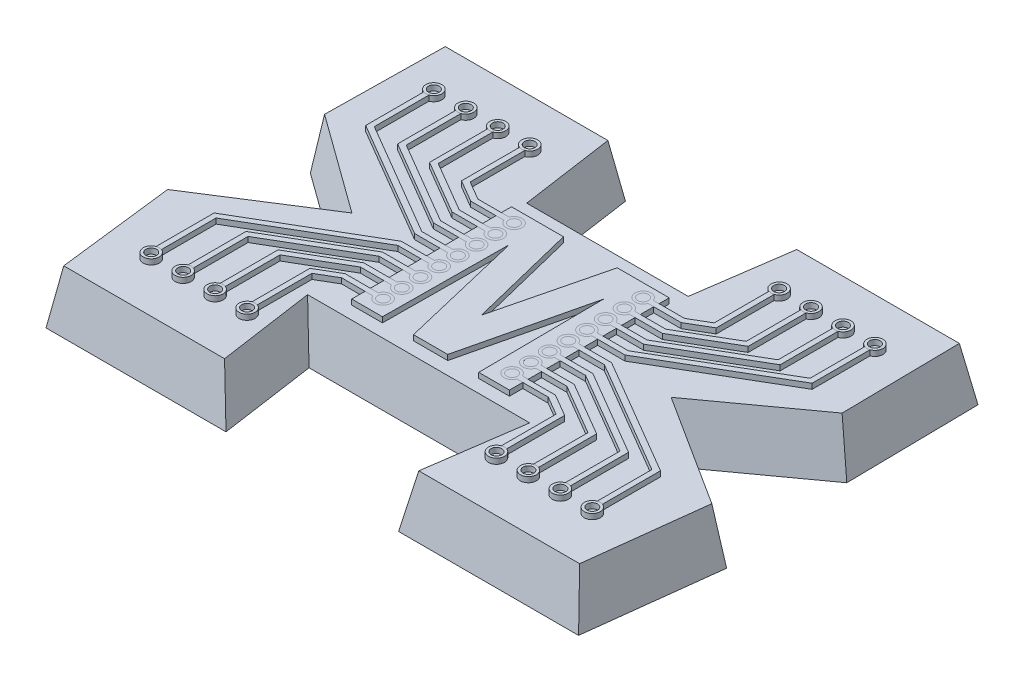
from build123d import *

# Parameters (mm, degrees)
EXTRUDE_X_DEPTH    = 20
EXTRUDE_X_TAPER    = 10
M_CUT_DEPTH        = 5
SKETCH_8_R         = 3
SKETCH_8_R_2       = 2
HOLES_CUT_DEPTH    = 5
SKETCH_9_R         = 3
SKETCH_9_R_2       = 2
M_HOLES_DEPTH      = 7
M_HOLES_2_DEPTH    = 7
M_HOLES_3_DEPTH    = 7
M_HOLES_4_DEPTH    = 7
M_HOLES_5_DEPTH    = 7
M_HOLES_6_DEPTH    = 7
M_HOLES_7_DEPTH    = 7
M_HOLES_8_DEPTH    = 7
M_HOLES_9_DEPTH    = 7
M_HOLES_10_DEPTH   = 7
M_HOLES_11_DEPTH   = 7
M_HOLES_12_DEPTH   = 7
M_HOLES_13_DEPTH   = 7
M_HOLES_14_DEPTH   = 7
M_HOLES_15_DEPTH   = 7
M_HOLES_16_DEPTH   = 7
ROUTES_DEPTH       = 2
ROUTES_DEPTH_BACK  = 5
SKETCH_11_R        = 2
EXTRUDE_M_DEPTH    = 7
EXTRUDE_M_2_DEPTH  = 7
EXTRUDE_M_3_DEPTH  = 7
EXTRUDE_M_4_DEPTH  = 7
EXTRUDE_M_5_DEPTH  = 7
EXTRUDE_M_6_DEPTH  = 7
EXTRUDE_M_7_DEPTH  = 7
EXTRUDE_M_8_DEPTH  = 7
EXTRUDE_M_9_DEPTH  = 7
EXTRUDE_M_10_DEPTH = 7
EXTRUDE_M_11_DEPTH = 7
EXTRUDE_M_12_DEPTH = 7
EXTRUDE_M_13_DEPTH = 7
EXTRUDE_M_14_DEPTH = 7
EXTRUDE_M_15_DEPTH = 7
EXTRUDE_M_16_DEPTH = 7
EXTRUDE_M_17_DEPTH = 7
SKETCH_14_R        = 3
SKETCH_14_R_2      = 2
HOLES_DEPTH        = 7
HOLES_2_DEPTH      = 7
HOLES_3_DEPTH      = 7
HOLES_4_DEPTH      = 7
HOLES_5_DEPTH      = 7
HOLES_6_DEPTH      = 7
HOLES_7_DEPTH      = 7
HOLES_8_DEPTH      = 7
HOLES_9_DEPTH      = 7
HOLES_10_DEPTH     = 7
HOLES_11_DEPTH     = 7
HOLES_12_DEPTH     = 7
HOLES_13_DEPTH     = 7
HOLES_14_DEPTH     = 7
HOLES_15_DEPTH     = 7
HOLES_16_DEPTH     = 7


with BuildPart() as part:
    # Эскиз1 → X (new body)
    with BuildSketch(Plane(origin=(0, 0, 0), x_dir=(1, 0, 0), z_dir=(0, 1, 0))):
        Polygon((0, 0), (67.599623535, 0), (62.359926215, 36.418021698), (137.640073785, 36.418021698), (132.400376465, 0), (200, 0), (205.94831436, 49.644914707), (166.200188233, 75), (200.728651396, 100.00530961), (200, 150), (132.400376465, 150), (127.274162693, 114.370734989), (72.725837307, 114.370734989), (67.599623535, 150), (0, 150), (-0.728651396, 100.00530961), (33.799811767, 75), (-5.94831436, 49.644914707), align=None)
    extrude(amount=EXTRUDE_X_DEPTH, taper=EXTRUDE_X_TAPER)

    # Эскиз6 → M cut (cut)
    with BuildSketch(Plane(origin=(0, 20, 0), x_dir=(1, 0, 0), z_dir=(0, 1, 0))):
        Polygon((70, 104.815168782), (70, 44.815168782), (81.538461538, 44.815168782), (81.923076923, 92.050745705), (93.185096154, 44.815168782), (106.045673077, 44.815168782), (117.307692308, 92.050745705), (117.692307692, 44.815168782), (129.230769231, 44.815168782), (129.230769231, 104.815168782), (109.711538462, 104.815168782), (99.615384615, 63.889688013), (89.519230769, 104.815168782), align=None)
    extrude(amount=-M_CUT_DEPTH, mode=Mode.SUBTRACT)

    # Эскиз8 → holes cut (cut)
    # profile 1 of 16: a face of its own
    with BuildSketch(Plane(origin=(0, 20, 0), x_dir=(1, 0, 0), z_dir=(0, 1, 0))):
        with Locations(Location((17.173553725, 128.473460386, 0), (0, 0, 270))):
            Circle(SKETCH_8_R)
        with Locations(Location((17.173553725, 128.473460386, 0), (0, 0, 270))):
            Circle(SKETCH_8_R_2, mode=Mode.SUBTRACT)
    # profile 2 of 16: a face of its own
    with BuildSketch(Plane(origin=(0, 20, 0), x_dir=(1, 0, 0), z_dir=(0, 1, 0))):
        with Locations(Location((29.173553725, 128.473460386, 0), (0, 0, 270))):
            Circle(SKETCH_8_R)
        with Locations(Location((29.173553725, 128.473460386, 0), (0, 0, 270))):
            Circle(SKETCH_8_R_2, mode=Mode.SUBTRACT)
    # profile 3 of 16: a face of its own
    with BuildSketch(Plane(origin=(0, 20, 0), x_dir=(1, 0, 0), z_dir=(0, 1, 0))):
        with Locations(Location((41.173553725, 128.473460386, 0), (0, 0, 270))):
            Circle(SKETCH_8_R)
        with Locations(Location((41.173553725, 128.473460386, 0), (0, 0, 270))):
            Circle(SKETCH_8_R_2, mode=Mode.SUBTRACT)
    # profile 4 of 16: a face of its own
    with BuildSketch(Plane(origin=(0, 20, 0), x_dir=(1, 0, 0), z_dir=(0, 1, 0))):
        with Locations(Location((53.173553725, 128.473460386, 0), (0, 0, 270))):
            Circle(SKETCH_8_R)
        with Locations(Location((53.173553725, 128.473460386, 0), (0, 0, 270))):
            Circle(SKETCH_8_R_2, mode=Mode.SUBTRACT)
    # profile 5 of 16: a face of its own
    with BuildSketch(Plane(origin=(0, 20, 0), x_dir=(1, 0, 0), z_dir=(0, 1, 0))):
        with Locations(Location((182.826446275, 22.326539614, 0), (0, 0, 270))):
            Circle(SKETCH_8_R)
        with Locations(Location((182.826446275, 22.326539614, 0), (0, 0, 270))):
            Circle(SKETCH_8_R_2, mode=Mode.SUBTRACT)
    # profile 6 of 16: a face of its own
    with BuildSketch(Plane(origin=(0, 20, 0), x_dir=(1, 0, 0), z_dir=(0, 1, 0))):
        with Locations(Location((170.826446275, 22.326539614, 0), (0, 0, 270))):
            Circle(SKETCH_8_R)
        with Locations(Location((170.826446275, 22.326539614, 0), (0, 0, 270))):
            Circle(SKETCH_8_R_2, mode=Mode.SUBTRACT)
    # profile 7 of 16: a face of its own
    with BuildSketch(Plane(origin=(0, 20, 0), x_dir=(1, 0, 0), z_dir=(0, 1, 0))):
        with Locations(Location((158.826446275, 22.326539614, 0), (0, 0, 270))):
            Circle(SKETCH_8_R)
        with Locations(Location((158.826446275, 22.326539614, 0), (0, 0, 270))):
            Circle(SKETCH_8_R_2, mode=Mode.SUBTRACT)
    # profile 8 of 16: a face of its own
    with BuildSketch(Plane(origin=(0, 20, 0), x_dir=(1, 0, 0), z_dir=(0, 1, 0))):
        with Locations(Location((146.826446275, 22.326539614, 0), (0, 0, 270))):
            Circle(SKETCH_8_R)
        with Locations(Location((146.826446275, 22.326539614, 0), (0, 0, 270))):
            Circle(SKETCH_8_R_2, mode=Mode.SUBTRACT)
    # profile 9 of 16: a face of its own
    with BuildSketch(Plane(origin=(0, 20, 0), x_dir=(1, 0, 0), z_dir=(0, 1, 0))):
        with Locations(Location((53.173553725, 22.326539614, 0), (0, 0, 90))):
            Circle(SKETCH_8_R)
        with Locations(Location((53.173553725, 22.326539614, 0), (0, 0, 90))):
            Circle(SKETCH_8_R_2, mode=Mode.SUBTRACT)
    # profile 10 of 16: a face of its own
    with BuildSketch(Plane(origin=(0, 20, 0), x_dir=(1, 0, 0), z_dir=(0, 1, 0))):
        with Locations(Location((41.173553725, 22.326539614, 0), (0, 0, 90))):
            Circle(SKETCH_8_R)
        with Locations(Location((41.173553725, 22.326539614, 0), (0, 0, 90))):
            Circle(SKETCH_8_R_2, mode=Mode.SUBTRACT)
    # profile 11 of 16: a face of its own
    with BuildSketch(Plane(origin=(0, 20, 0), x_dir=(1, 0, 0), z_dir=(0, 1, 0))):
        with Locations(Location((29.173553725, 22.326539614, 0), (0, 0, 90))):
            Circle(SKETCH_8_R)
        with Locations(Location((29.173553725, 22.326539614, 0), (0, 0, 90))):
            Circle(SKETCH_8_R_2, mode=Mode.SUBTRACT)
    # profile 12 of 16: a face of its own
    with BuildSketch(Plane(origin=(0, 20, 0), x_dir=(1, 0, 0), z_dir=(0, 1, 0))):
        with Locations(Location((17.173553725, 22.326539614, 0), (0, 0, 90))):
            Circle(SKETCH_8_R)
        with Locations(Location((17.173553725, 22.326539614, 0), (0, 0, 90))):
            Circle(SKETCH_8_R_2, mode=Mode.SUBTRACT)
    # profile 13 of 16: a face of its own
    with BuildSketch(Plane(origin=(0, 20, 0), x_dir=(1, 0, 0), z_dir=(0, 1, 0))):
        with Locations(Location((146.826446275, 128.473460386, 0), (0, 0, 90))):
            Circle(SKETCH_8_R)
        with Locations(Location((146.826446275, 128.473460386, 0), (0, 0, 90))):
            Circle(SKETCH_8_R_2, mode=Mode.SUBTRACT)
    # profile 14 of 16: a face of its own
    with BuildSketch(Plane(origin=(0, 20, 0), x_dir=(1, 0, 0), z_dir=(0, 1, 0))):
        with Locations(Location((158.826446275, 128.473460386, 0), (0, 0, 90))):
            Circle(SKETCH_8_R)
        with Locations(Location((158.826446275, 128.473460386, 0), (0, 0, 90))):
            Circle(SKETCH_8_R_2, mode=Mode.SUBTRACT)
    # profile 15 of 16: a face of its own
    with BuildSketch(Plane(origin=(0, 20, 0), x_dir=(1, 0, 0), z_dir=(0, 1, 0))):
        with Locations(Location((170.826446275, 128.473460386, 0), (0, 0, 90))):
            Circle(SKETCH_8_R)
        with Locations(Location((170.826446275, 128.473460386, 0), (0, 0, 90))):
            Circle(SKETCH_8_R_2, mode=Mode.SUBTRACT)
    # profile 16 of 16: a face of its own
    with BuildSketch(Plane(origin=(0, 20, 0), x_dir=(1, 0, 0), z_dir=(0, 1, 0))):
        with Locations(Location((182.826446275, 128.473460386, 0), (0, 0, 90))):
            Circle(SKETCH_8_R)
        with Locations(Location((182.826446275, 128.473460386, 0), (0, 0, 90))):
            Circle(SKETCH_8_R_2, mode=Mode.SUBTRACT)
    extrude(amount=-HOLES_CUT_DEPTH, mode=Mode.SUBTRACT)



with BuildPart() as body_2:
    # Эскиз9 → M holes (new body)
    with BuildSketch(Plane(origin=(0, 15, 0), x_dir=(1, 0, 0), z_dir=(0, 1, 0))):
        with Locations(Location((75.769230769, 50.815168782, 0), (0, 0, 270))):
            Circle(SKETCH_9_R)
        with Locations(Location((75.769230769, 50.815168782, 0), (0, 0, 270))):
            Circle(SKETCH_9_R_2, mode=Mode.SUBTRACT)
    extrude(amount=M_HOLES_DEPTH)


with BuildPart() as body_3:
    # Эскиз9 → M holes 2 (new body)
    with BuildSketch(Plane(origin=(0, 15, 0), x_dir=(1, 0, 0), z_dir=(0, 1, 0))):
        with Locations(Location((75.769230769, 57.841573241, 0), (0, 0, 270))):
            Circle(SKETCH_9_R)
        with Locations(Location((75.769230769, 57.841573241, 0), (0, 0, 270))):
            Circle(SKETCH_9_R_2, mode=Mode.SUBTRACT)
    extrude(amount=M_HOLES_2_DEPTH)


with BuildPart() as body_4:
    # Эскиз9 → M holes 3 (new body)
    with BuildSketch(Plane(origin=(0, 15, 0), x_dir=(1, 0, 0), z_dir=(0, 1, 0))):
        with Locations(Location((75.769230769, 64.867977701, 0), (0, 0, 270))):
            Circle(SKETCH_9_R)
        with Locations(Location((75.769230769, 64.867977701, 0), (0, 0, 270))):
            Circle(SKETCH_9_R_2, mode=Mode.SUBTRACT)
    extrude(amount=M_HOLES_3_DEPTH)


with BuildPart() as body_5:
    # Эскиз9 → M holes 4 (new body)
    with BuildSketch(Plane(origin=(0, 15, 0), x_dir=(1, 0, 0), z_dir=(0, 1, 0))):
        with Locations(Location((75.769230769, 71.894382161, 0), (0, 0, 270))):
            Circle(SKETCH_9_R)
        with Locations(Location((75.769230769, 71.894382161, 0), (0, 0, 270))):
            Circle(SKETCH_9_R_2, mode=Mode.SUBTRACT)
    extrude(amount=M_HOLES_4_DEPTH)


with BuildPart() as body_6:
    # Эскиз9 → M holes 5 (new body)
    with BuildSketch(Plane(origin=(0, 15, 0), x_dir=(1, 0, 0), z_dir=(0, 1, 0))):
        with Locations(Location((75.769230769, 78.920786621, 0), (0, 0, 270))):
            Circle(SKETCH_9_R)
        with Locations(Location((75.769230769, 78.920786621, 0), (0, 0, 270))):
            Circle(SKETCH_9_R_2, mode=Mode.SUBTRACT)
    extrude(amount=M_HOLES_5_DEPTH)


with BuildPart() as body_7:
    # Эскиз9 → M holes 6 (new body)
    with BuildSketch(Plane(origin=(0, 15, 0), x_dir=(1, 0, 0), z_dir=(0, 1, 0))):
        with Locations(Location((75.769230769, 85.94719108, 0), (0, 0, 270))):
            Circle(SKETCH_9_R)
        with Locations(Location((75.769230769, 85.94719108, 0), (0, 0, 270))):
            Circle(SKETCH_9_R_2, mode=Mode.SUBTRACT)
    extrude(amount=M_HOLES_6_DEPTH)


with BuildPart() as body_8:
    # Эскиз9 → M holes 7 (new body)
    with BuildSketch(Plane(origin=(0, 15, 0), x_dir=(1, 0, 0), z_dir=(0, 1, 0))):
        with Locations(Location((75.769230769, 92.97359554, 0), (0, 0, 270))):
            Circle(SKETCH_9_R)
        with Locations(Location((75.769230769, 92.97359554, 0), (0, 0, 270))):
            Circle(SKETCH_9_R_2, mode=Mode.SUBTRACT)
    extrude(amount=M_HOLES_7_DEPTH)


with BuildPart() as body_9:
    # Эскиз9 → M holes 8 (new body)
    with BuildSketch(Plane(origin=(0, 15, 0), x_dir=(1, 0, 0), z_dir=(0, 1, 0))):
        with Locations(Location((75.769230769, 100, 0), (0, 0, 270))):
            Circle(SKETCH_9_R)
        with Locations(Location((75.769230769, 100, 0), (0, 0, 270))):
            Circle(SKETCH_9_R_2, mode=Mode.SUBTRACT)
    extrude(amount=M_HOLES_8_DEPTH)


with BuildPart() as body_10:
    # Эскиз9 → M holes 9 (new body)
    with BuildSketch(Plane(origin=(0, 15, 0), x_dir=(1, 0, 0), z_dir=(0, 1, 0))):
        with Locations(Location((124.230769231, 100, 0), (0, 0, 90))):
            Circle(SKETCH_9_R)
        with Locations(Location((124.230769231, 100, 0), (0, 0, 90))):
            Circle(SKETCH_9_R_2, mode=Mode.SUBTRACT)
    extrude(amount=M_HOLES_9_DEPTH)


with BuildPart() as body_11:
    # Эскиз9 → M holes 10 (new body)
    with BuildSketch(Plane(origin=(0, 15, 0), x_dir=(1, 0, 0), z_dir=(0, 1, 0))):
        with Locations(Location((124.230769231, 92.97359554, 0), (0, 0, 90))):
            Circle(SKETCH_9_R)
        with Locations(Location((124.230769231, 92.97359554, 0), (0, 0, 90))):
            Circle(SKETCH_9_R_2, mode=Mode.SUBTRACT)
    extrude(amount=M_HOLES_10_DEPTH)


with BuildPart() as body_12:
    # Эскиз9 → M holes 11 (new body)
    with BuildSketch(Plane(origin=(0, 15, 0), x_dir=(1, 0, 0), z_dir=(0, 1, 0))):
        with Locations(Location((124.230769231, 85.94719108, 0), (0, 0, 90))):
            Circle(SKETCH_9_R)
        with Locations(Location((124.230769231, 85.94719108, 0), (0, 0, 90))):
            Circle(SKETCH_9_R_2, mode=Mode.SUBTRACT)
    extrude(amount=M_HOLES_11_DEPTH)


with BuildPart() as body_13:
    # Эскиз9 → M holes 12 (new body)
    with BuildSketch(Plane(origin=(0, 15, 0), x_dir=(1, 0, 0), z_dir=(0, 1, 0))):
        with Locations(Location((124.230769231, 78.920786621, 0), (0, 0, 90))):
            Circle(SKETCH_9_R)
        with Locations(Location((124.230769231, 78.920786621, 0), (0, 0, 90))):
            Circle(SKETCH_9_R_2, mode=Mode.SUBTRACT)
    extrude(amount=M_HOLES_12_DEPTH)


with BuildPart() as body_14:
    # Эскиз9 → M holes 13 (new body)
    with BuildSketch(Plane(origin=(0, 15, 0), x_dir=(1, 0, 0), z_dir=(0, 1, 0))):
        with Locations(Location((124.230769231, 71.894382161, 0), (0, 0, 90))):
            Circle(SKETCH_9_R)
        with Locations(Location((124.230769231, 71.894382161, 0), (0, 0, 90))):
            Circle(SKETCH_9_R_2, mode=Mode.SUBTRACT)
    extrude(amount=M_HOLES_13_DEPTH)


with BuildPart() as body_15:
    # Эскиз9 → M holes 14 (new body)
    with BuildSketch(Plane(origin=(0, 15, 0), x_dir=(1, 0, 0), z_dir=(0, 1, 0))):
        with Locations(Location((124.230769231, 64.867977701, 0), (0, 0, 90))):
            Circle(SKETCH_9_R)
        with Locations(Location((124.230769231, 64.867977701, 0), (0, 0, 90))):
            Circle(SKETCH_9_R_2, mode=Mode.SUBTRACT)
    extrude(amount=M_HOLES_14_DEPTH)


with BuildPart() as body_16:
    # Эскиз9 → M holes 15 (new body)
    with BuildSketch(Plane(origin=(0, 15, 0), x_dir=(1, 0, 0), z_dir=(0, 1, 0))):
        with Locations(Location((124.230769231, 57.841573241, 0), (0, 0, 90))):
            Circle(SKETCH_9_R)
        with Locations(Location((124.230769231, 57.841573241, 0), (0, 0, 90))):
            Circle(SKETCH_9_R_2, mode=Mode.SUBTRACT)
    extrude(amount=M_HOLES_15_DEPTH)


with BuildPart() as body_17:
    # Эскиз9 → M holes 16 (new body)
    with BuildSketch(Plane(origin=(0, 15, 0), x_dir=(1, 0, 0), z_dir=(0, 1, 0))):
        with Locations(Location((124.230769231, 50.815168782, 0), (0, 0, 90))):
            Circle(SKETCH_9_R)
        with Locations(Location((124.230769231, 50.815168782, 0), (0, 0, 90))):
            Circle(SKETCH_9_R_2, mode=Mode.SUBTRACT)
    extrude(amount=M_HOLES_16_DEPTH)


with BuildPart() as part_1:
    add(part.part)

    add(body_2.part)  # routes merges body 2

    add(body_3.part)  # routes merges body 3

    add(body_4.part)  # routes merges body 4

    add(body_5.part)  # routes merges body 5

    add(body_6.part)  # routes merges body 6

    add(body_7.part)  # routes merges body 7

    add(body_8.part)  # routes merges body 8

    add(body_9.part)  # routes merges body 9

    add(body_10.part)  # routes merges body 10

    add(body_11.part)  # routes merges body 11

    add(body_12.part)  # routes merges body 12

    add(body_13.part)  # routes merges body 13

    add(body_14.part)  # routes merges body 14

    add(body_15.part)  # routes merges body 15

    add(body_16.part)  # routes merges body 16

    add(body_17.part)  # routes merges body 17
    # Эскиз10 → routes (add, two sides: drawn at the far end of the back side and taken through both)
    with BuildSketch(Plane(origin=(0, 20, 0), x_dir=(1, 0, 0), z_dir=(0, 1, 0)).offset(-ROUTES_DEPTH_BACK)):
        with BuildLine():
            Line((18.173553725, 105.117996806), (61.206448281, 79.920786621))
            Line((61.206448281, 79.920786621), (72.940803644, 79.920786621))
            ThreePointArc((72.940803644, 79.920786621), (72.769230769, 78.920786621), (72.940803644, 77.920786621))
            Line((72.940803644, 77.920786621), (60.500642582, 77.920786621))
            Line((60.500642582, 77.920786621), (16.173553725, 103.87579119))
            Line((16.173553725, 103.87579119), (16.173553725, 125.645033261))
            ThreePointArc((16.173553725, 125.645033261), (17.173553725, 125.473460386), (18.173553725, 125.645033261))
            Line((18.173553725, 125.645033261), (18.173553725, 105.117996806))
        make_face()
        with BuildLine():
            Line((30.173553725, 105.114430919), (61.200358304, 86.94719108))
            Line((61.200358304, 86.94719108), (72.940803644, 86.94719108))
            ThreePointArc((72.940803644, 86.94719108), (72.769230769, 85.94719108), (72.940803644, 84.94719108))
            Line((72.940803644, 84.94719108), (60.506732559, 84.94719108))
            Line((60.506732559, 84.94719108), (28.173553725, 103.879357077))
            Line((28.173553725, 103.879357077), (28.173553725, 125.645033261))
            ThreePointArc((28.173553725, 125.645033261), (29.173553725, 125.473460386), (30.173553725, 125.645033261))
            Line((30.173553725, 125.645033261), (30.173553725, 105.114430919))
        make_face()
        with BuildLine():
            Line((42.173553725, 105.122325062), (61.213840266, 93.97359554))
            Line((61.213840266, 93.97359554), (72.940803644, 93.97359554))
            ThreePointArc((72.940803644, 93.97359554), (72.769230769, 92.97359554), (72.940803644, 91.97359554))
            Line((72.940803644, 91.97359554), (60.493250597, 91.97359554))
            Line((60.493250597, 91.97359554), (40.173553725, 103.871462934))
            Line((40.173553725, 103.871462934), (40.173553725, 125.645033261))
            ThreePointArc((40.173553725, 125.645033261), (41.173553725, 125.473460386), (42.173553725, 125.645033261))
            Line((42.173553725, 125.645033261), (42.173553725, 105.122325062))
        make_face()
        with BuildLine():
            Line((54.173553725, 105.11737069), (61.205378972, 101))
            Line((61.205378972, 101), (72.940803644, 101))
            ThreePointArc((72.940803644, 101), (72.769230769, 100), (72.940803644, 99))
            Line((72.940803644, 99), (60.501711891, 99))
            Line((60.501711891, 99), (52.173553725, 103.876417307))
            Line((52.173553725, 103.876417307), (52.173553725, 125.645033261))
            ThreePointArc((52.173553725, 125.645033261), (53.173553725, 125.473460386), (54.173553725, 125.645033261))
            Line((54.173553725, 125.645033261), (54.173553725, 105.11737069))
        make_face()
        with BuildLine():
            Line((127.059196356, 99), (139.498288109, 99))
            Line((139.498288109, 99), (147.826446275, 103.876417307))
            Line((147.826446275, 103.876417307), (147.826446275, 125.645033261))
            ThreePointArc((147.826446275, 125.645033261), (146.826446275, 125.473460386), (145.826446275, 125.645033261))
            Line((145.826446275, 125.645033261), (145.826446275, 105.11737069))
            Line((145.826446275, 105.11737069), (138.794621028, 101))
            Line((138.794621028, 101), (127.059196356, 101))
            ThreePointArc((127.059196356, 101), (127.230769231, 100), (127.059196356, 99))
        make_face()
        with BuildLine():
            Line((127.059196356, 91.97359554), (139.506749403, 91.97359554))
            Line((139.506749403, 91.97359554), (159.826446275, 103.871462934))
            Line((159.826446275, 103.871462934), (159.826446275, 125.645033261))
            ThreePointArc((159.826446275, 125.645033261), (158.826446275, 125.473460386), (157.826446275, 125.645033261))
            Line((157.826446275, 125.645033261), (157.826446275, 105.122325062))
            Line((157.826446275, 105.122325062), (138.786159734, 93.97359554))
            Line((138.786159734, 93.97359554), (127.059196356, 93.97359554))
            ThreePointArc((127.059196356, 93.97359554), (127.230769231, 92.97359554), (127.059196356, 91.97359554))
        make_face()
        with BuildLine():
            Line((127.059196356, 84.94719108), (139.493267441, 84.94719108))
            Line((139.493267441, 84.94719108), (171.826446275, 103.879357077))
            Line((171.826446275, 103.879357077), (171.826446275, 125.645033261))
            ThreePointArc((171.826446275, 125.645033261), (170.826446275, 125.473460386), (169.826446275, 125.645033261))
            Line((169.826446275, 125.645033261), (169.826446275, 105.114430919))
            Line((169.826446275, 105.114430919), (138.799641696, 86.94719108))
            Line((138.799641696, 86.94719108), (127.059196356, 86.94719108))
            ThreePointArc((127.059196356, 86.94719108), (127.230769231, 85.94719108), (127.059196356, 84.94719108))
        make_face()
        with BuildLine():
            Line((183.826446275, 125.645033261), (183.826446275, 103.87579119))
            Line((183.826446275, 103.87579119), (139.499357418, 77.920786621))
            Line((139.499357418, 77.920786621), (127.059196356, 77.920786621))
            ThreePointArc((127.059196356, 77.920786621), (127.230769231, 78.920786621), (127.059196356, 79.920786621))
            Line((127.059196356, 79.920786621), (138.793551719, 79.920786621))
            Line((138.793551719, 79.920786621), (181.826446275, 105.117996806))
            Line((181.826446275, 105.117996806), (181.826446275, 125.645033261))
            ThreePointArc((181.826446275, 125.645033261), (182.826446275, 125.473460386), (183.826446275, 125.645033261))
        make_face()
        with BuildLine():
            Line((181.826446275, 45.697171976), (138.793551719, 70.894382161))
            Line((138.793551719, 70.894382161), (127.059196356, 70.894382161))
            ThreePointArc((127.059196356, 70.894382161), (127.230769231, 71.894382161), (127.059196356, 72.894382161))
            Line((127.059196356, 72.894382161), (139.499357418, 72.894382161))
            Line((139.499357418, 72.894382161), (183.826446275, 46.939377592))
            Line((183.826446275, 46.939377592), (183.826446275, 25.170135521))
            ThreePointArc((183.826446275, 25.170135521), (182.826446275, 25.341708396), (181.826446275, 25.170135521))
            Line((181.826446275, 25.170135521), (181.826446275, 45.697171976))
        make_face()
        with BuildLine():
            Line((169.826446275, 45.700737862), (138.799641696, 63.867977701))
            Line((138.799641696, 63.867977701), (127.059196356, 63.867977701))
            ThreePointArc((127.059196356, 63.867977701), (127.230769231, 64.867977701), (127.059196356, 65.867977701))
            Line((127.059196356, 65.867977701), (139.493267441, 65.867977701))
            Line((139.493267441, 65.867977701), (171.826446275, 46.935811705))
            Line((171.826446275, 46.935811705), (171.826446275, 25.170135521))
            ThreePointArc((171.826446275, 25.170135521), (170.826446275, 25.341708396), (169.826446275, 25.170135521))
            Line((169.826446275, 25.170135521), (169.826446275, 45.700737862))
        make_face()
        with BuildLine():
            Line((157.826446275, 45.692843719), (138.786159734, 56.841573241))
            Line((138.786159734, 56.841573241), (127.059196356, 56.841573241))
            ThreePointArc((127.059196356, 56.841573241), (127.230769231, 57.841573241), (127.059196356, 58.841573241))
            Line((127.059196356, 58.841573241), (139.506749403, 58.841573241))
            Line((139.506749403, 58.841573241), (159.826446275, 46.943705848))
            Line((159.826446275, 46.943705848), (159.826446275, 25.170135521))
            ThreePointArc((159.826446275, 25.170135521), (158.826446275, 25.341708396), (157.826446275, 25.170135521))
            Line((157.826446275, 25.170135521), (157.826446275, 45.692843719))
        make_face()
        with BuildLine():
            Line((145.826446275, 45.697798092), (138.794621028, 49.815168782))
            Line((138.794621028, 49.815168782), (127.059196356, 49.815168782))
            ThreePointArc((127.059196356, 49.815168782), (127.230769231, 50.815168782), (127.059196356, 51.815168782))
            Line((127.059196356, 51.815168782), (139.498288109, 51.815168782))
            Line((139.498288109, 51.815168782), (147.826446275, 46.938751475))
            Line((147.826446275, 46.938751475), (147.826446275, 25.170135521))
            ThreePointArc((147.826446275, 25.170135521), (146.826446275, 25.341708396), (145.826446275, 25.170135521))
            Line((145.826446275, 25.170135521), (145.826446275, 45.697798092))
        make_face()
        with BuildLine():
            Line((72.940803644, 51.815168782), (60.501711891, 51.815168782))
            Line((60.501711891, 51.815168782), (52.173553725, 46.938751475))
            Line((52.173553725, 46.938751475), (52.173553725, 25.170135521))
            ThreePointArc((52.173553725, 25.170135521), (53.173553725, 25.341708396), (54.173553725, 25.170135521))
            Line((54.173553725, 25.170135521), (54.173553725, 45.697798092))
            Line((54.173553725, 45.697798092), (61.205378972, 49.815168782))
            Line((61.205378972, 49.815168782), (72.940803644, 49.815168782))
            ThreePointArc((72.940803644, 49.815168782), (72.769230769, 50.815168782), (72.940803644, 51.815168782))
        make_face()
        with BuildLine():
            Line((72.940803644, 58.841573241), (60.493250597, 58.841573241))
            Line((60.493250597, 58.841573241), (40.173553725, 46.943705848))
            Line((40.173553725, 46.943705848), (40.173553725, 25.170135521))
            ThreePointArc((40.173553725, 25.170135521), (41.173553725, 25.341708396), (42.173553725, 25.170135521))
            Line((42.173553725, 25.170135521), (42.173553725, 45.692843719))
            Line((42.173553725, 45.692843719), (61.213840266, 56.841573241))
            Line((61.213840266, 56.841573241), (72.940803644, 56.841573241))
            ThreePointArc((72.940803644, 56.841573241), (72.769230769, 57.841573241), (72.940803644, 58.841573241))
        make_face()
        with BuildLine():
            Line((72.940803644, 65.867977701), (60.506732559, 65.867977701))
            Line((60.506732559, 65.867977701), (28.173553725, 46.935811705))
            Line((28.173553725, 46.935811705), (28.173553725, 25.170135521))
            ThreePointArc((28.173553725, 25.170135521), (29.173553725, 25.341708396), (30.173553725, 25.170135521))
            Line((30.173553725, 25.170135521), (30.173553725, 45.700737862))
            Line((30.173553725, 45.700737862), (61.200358304, 63.867977701))
            Line((61.200358304, 63.867977701), (72.940803644, 63.867977701))
            ThreePointArc((72.940803644, 63.867977701), (72.769230769, 64.867977701), (72.940803644, 65.867977701))
        make_face()
        with BuildLine():
            Line((16.173553725, 25.170135521), (16.173553725, 46.939377592))
            Line((16.173553725, 46.939377592), (60.500642582, 72.894382161))
            Line((60.500642582, 72.894382161), (72.940803644, 72.894382161))
            ThreePointArc((72.940803644, 72.894382161), (72.769230769, 71.894382161), (72.940803644, 70.894382161))
            Line((72.940803644, 70.894382161), (61.206448281, 70.894382161))
            Line((61.206448281, 70.894382161), (18.173553725, 45.697171976))
            Line((18.173553725, 45.697171976), (18.173553725, 25.170135521))
            ThreePointArc((18.173553725, 25.170135521), (17.173553725, 25.341708396), (16.173553725, 25.170135521))
        make_face()
    extrude(amount=ROUTES_DEPTH + ROUTES_DEPTH_BACK)


with BuildPart() as body_2_2:
    # Эскиз11 → M (new body)
    with BuildSketch(Plane(origin=(0, 15, 0), x_dir=(1, 0, 0), z_dir=(0, 1, 0))):
        with Locations(Location((75.769230769, 100, 0), (0, 0, 270))):
            Circle(SKETCH_11_R)
    extrude(amount=EXTRUDE_M_DEPTH)


with BuildPart() as body_3_2:
    # Эскиз11 → Extrude M 2 (new body)
    with BuildSketch(Plane(origin=(0, 15, 0), x_dir=(1, 0, 0), z_dir=(0, 1, 0))):
        with Locations(Location((75.769230769, 92.97359554, 0), (0, 0, 270))):
            Circle(SKETCH_11_R)
    extrude(amount=EXTRUDE_M_2_DEPTH)


with BuildPart() as body_4_2:
    # Эскиз11 → Extrude M 3 (new body)
    with BuildSketch(Plane(origin=(0, 15, 0), x_dir=(1, 0, 0), z_dir=(0, 1, 0))):
        with Locations(Location((75.769230769, 85.94719108, 0), (0, 0, 270))):
            Circle(SKETCH_11_R)
    extrude(amount=EXTRUDE_M_3_DEPTH)


with BuildPart() as body_5_2:
    # Эскиз11 → Extrude M 4 (new body)
    with BuildSketch(Plane(origin=(0, 15, 0), x_dir=(1, 0, 0), z_dir=(0, 1, 0))):
        with Locations(Location((75.769230769, 78.920786621, 0), (0, 0, 270))):
            Circle(SKETCH_11_R)
    extrude(amount=EXTRUDE_M_4_DEPTH)


with BuildPart() as body_6_2:
    # Эскиз11 → Extrude M 5 (new body)
    with BuildSketch(Plane(origin=(0, 15, 0), x_dir=(1, 0, 0), z_dir=(0, 1, 0))):
        with Locations(Location((75.769230769, 71.894382161, 0), (0, 0, 270))):
            Circle(SKETCH_11_R)
    extrude(amount=EXTRUDE_M_5_DEPTH)


with BuildPart() as body_7_2:
    # Эскиз11 → Extrude M 6 (new body)
    with BuildSketch(Plane(origin=(0, 15, 0), x_dir=(1, 0, 0), z_dir=(0, 1, 0))):
        with Locations(Location((75.769230769, 64.867977701, 0), (0, 0, 270))):
            Circle(SKETCH_11_R)
    extrude(amount=EXTRUDE_M_6_DEPTH)


with BuildPart() as body_8_2:
    # Эскиз11 → Extrude M 7 (new body)
    with BuildSketch(Plane(origin=(0, 15, 0), x_dir=(1, 0, 0), z_dir=(0, 1, 0))):
        with Locations(Location((75.769230769, 57.841573241, 0), (0, 0, 270))):
            Circle(SKETCH_11_R)
    extrude(amount=EXTRUDE_M_7_DEPTH)


with BuildPart() as body_9_2:
    # Эскиз11 → Extrude M 8 (new body)
    with BuildSketch(Plane(origin=(0, 15, 0), x_dir=(1, 0, 0), z_dir=(0, 1, 0))):
        with Locations(Location((75.769230769, 50.815168782, 0), (0, 0, 270))):
            Circle(SKETCH_11_R)
    extrude(amount=EXTRUDE_M_8_DEPTH)


with BuildPart() as body_10_2:
    # Эскиз11 → Extrude M 9 (new body)
    with BuildSketch(Plane(origin=(0, 15, 0), x_dir=(1, 0, 0), z_dir=(0, 1, 0))):
        with Locations(Location((124.230769231, 100, 0), (0, 0, 270))):
            Circle(SKETCH_11_R)
    extrude(amount=EXTRUDE_M_9_DEPTH)


with BuildPart() as body_11_2:
    # Эскиз11 → Extrude M 10 (new body)
    with BuildSketch(Plane(origin=(0, 15, 0), x_dir=(1, 0, 0), z_dir=(0, 1, 0))):
        with Locations(Location((124.230769231, 92.97359554, 0), (0, 0, 270))):
            Circle(SKETCH_11_R)
    extrude(amount=EXTRUDE_M_10_DEPTH)


with BuildPart() as body_12_2:
    # Эскиз11 → Extrude M 11 (new body)
    with BuildSketch(Plane(origin=(0, 15, 0), x_dir=(1, 0, 0), z_dir=(0, 1, 0))):
        with Locations(Location((124.230769231, 85.94719108, 0), (0, 0, 270))):
            Circle(SKETCH_11_R)
    extrude(amount=EXTRUDE_M_11_DEPTH)


with BuildPart() as body_13_2:
    # Эскиз11 → Extrude M 12 (new body)
    with BuildSketch(Plane(origin=(0, 15, 0), x_dir=(1, 0, 0), z_dir=(0, 1, 0))):
        with Locations(Location((124.230769231, 78.920786621, 0), (0, 0, 270))):
            Circle(SKETCH_11_R)
    extrude(amount=EXTRUDE_M_12_DEPTH)


with BuildPart() as body_14_2:
    # Эскиз11 → Extrude M 13 (new body)
    with BuildSketch(Plane(origin=(0, 15, 0), x_dir=(1, 0, 0), z_dir=(0, 1, 0))):
        with Locations(Location((124.230769231, 71.894382161, 0), (0, 0, 270))):
            Circle(SKETCH_11_R)
    extrude(amount=EXTRUDE_M_13_DEPTH)


with BuildPart() as body_15_2:
    # Эскиз11 → Extrude M 14 (new body)
    with BuildSketch(Plane(origin=(0, 15, 0), x_dir=(1, 0, 0), z_dir=(0, 1, 0))):
        with Locations(Location((124.230769231, 64.867977701, 0), (0, 0, 270))):
            Circle(SKETCH_11_R)
    extrude(amount=EXTRUDE_M_14_DEPTH)


with BuildPart() as body_16_2:
    # Эскиз11 → Extrude M 15 (new body)
    with BuildSketch(Plane(origin=(0, 15, 0), x_dir=(1, 0, 0), z_dir=(0, 1, 0))):
        with Locations(Location((124.230769231, 50.815168782, 0), (0, 0, 270))):
            Circle(SKETCH_11_R)
    extrude(amount=EXTRUDE_M_15_DEPTH)


with BuildPart() as body_17_2:
    # Эскиз11 → Extrude M 16 (new body)
    with BuildSketch(Plane(origin=(0, 15, 0), x_dir=(1, 0, 0), z_dir=(0, 1, 0))):
        with Locations(Location((124.230769231, 57.841573241, 0), (0, 0, 270))):
            Circle(SKETCH_11_R)
    extrude(amount=EXTRUDE_M_16_DEPTH)


with BuildPart() as body_18:
    # Эскиз11 → Extrude M 17 (new body)
    with BuildSketch(Plane(origin=(0, 15, 0), x_dir=(1, 0, 0), z_dir=(0, 1, 0))):
        with BuildLine():
            Line((81.923076923, 92.050745705), (81.538461538, 44.815168782))
            Line((81.538461538, 44.815168782), (70, 44.815168782))
            Line((70, 44.815168782), (70, 49.815168782))
            Line((70, 49.815168782), (72.940803644, 49.815168782))
            ThreePointArc((72.940803644, 49.815168782), (78.769230769, 50.815168782), (72.940803644, 51.815168782))
            Line((72.940803644, 51.815168782), (70, 51.815168782))
            Line((70, 51.815168782), (70, 56.841573241))
            Line((70, 56.841573241), (72.940803644, 56.841573241))
            ThreePointArc((72.940803644, 56.841573241), (78.769230769, 57.841573241), (72.940803644, 58.841573241))
            Line((72.940803644, 58.841573241), (70, 58.841573241))
            Line((70, 58.841573241), (70, 63.867977701))
            Line((70, 63.867977701), (72.940803644, 63.867977701))
            ThreePointArc((72.940803644, 63.867977701), (78.769230769, 64.867977701), (72.940803644, 65.867977701))
            Line((72.940803644, 65.867977701), (70, 65.867977701))
            Line((70, 65.867977701), (70, 70.894382161))
            Line((70, 70.894382161), (72.940803644, 70.894382161))
            ThreePointArc((72.940803644, 70.894382161), (78.769230769, 71.894382161), (72.940803644, 72.894382161))
            Line((72.940803644, 72.894382161), (70, 72.894382161))
            Line((70, 72.894382161), (70, 77.920786621))
            Line((70, 77.920786621), (72.940803644, 77.920786621))
            ThreePointArc((72.940803644, 77.920786621), (78.769230769, 78.920786621), (72.940803644, 79.920786621))
            Line((72.940803644, 79.920786621), (70, 79.920786621))
            Line((70, 79.920786621), (70, 84.94719108))
            Line((70, 84.94719108), (72.940803644, 84.94719108))
            ThreePointArc((72.940803644, 84.94719108), (78.769230769, 85.94719108), (72.940803644, 86.94719108))
            Line((72.940803644, 86.94719108), (70, 86.94719108))
            Line((70, 86.94719108), (70, 91.97359554))
            Line((70, 91.97359554), (72.940803644, 91.97359554))
            ThreePointArc((72.940803644, 91.97359554), (78.769230769, 92.97359554), (72.940803644, 93.97359554))
            Line((72.940803644, 93.97359554), (70, 93.97359554))
            Line((70, 93.97359554), (70, 99))
            Line((70, 99), (72.940803644, 99))
            ThreePointArc((72.940803644, 99), (78.769230769, 100), (72.940803644, 101))
            Line((72.940803644, 101), (70, 101))
            Line((70, 101), (70, 104.815168782))
            Line((70, 104.815168782), (89.519230769, 104.815168782))
            Line((89.519230769, 104.815168782), (99.615384615, 63.889688013))
            Line((99.615384615, 63.889688013), (109.711538462, 104.815168782))
            Line((109.711538462, 104.815168782), (129.230769231, 104.815168782))
            Line((129.230769231, 104.815168782), (129.230769231, 101))
            Line((129.230769231, 101), (127.059196356, 101))
            ThreePointArc((127.059196356, 101), (121.230769231, 100), (127.059196356, 99))
            Line((127.059196356, 99), (129.230769231, 99))
            Line((129.230769231, 99), (129.230769231, 93.97359554))
            Line((129.230769231, 93.97359554), (127.059196356, 93.97359554))
            ThreePointArc((127.059196356, 93.97359554), (121.230769231, 92.97359554), (127.059196356, 91.97359554))
            Line((127.059196356, 91.97359554), (129.230769231, 91.97359554))
            Line((129.230769231, 91.97359554), (129.230769231, 86.94719108))
            Line((129.230769231, 86.94719108), (127.059196356, 86.94719108))
            ThreePointArc((127.059196356, 86.94719108), (121.230769231, 85.94719108), (127.059196356, 84.94719108))
            Line((127.059196356, 84.94719108), (129.230769231, 84.94719108))
            Line((129.230769231, 84.94719108), (129.230769231, 79.920786621))
            Line((129.230769231, 79.920786621), (127.059196356, 79.920786621))
            ThreePointArc((127.059196356, 79.920786621), (121.230769231, 78.920786621), (127.059196356, 77.920786621))
            Line((127.059196356, 77.920786621), (129.230769231, 77.920786621))
            Line((129.230769231, 77.920786621), (129.230769231, 72.894382161))
            Line((129.230769231, 72.894382161), (127.059196356, 72.894382161))
            ThreePointArc((127.059196356, 72.894382161), (121.230769231, 71.894382161), (127.059196356, 70.894382161))
            Line((127.059196356, 70.894382161), (129.230769231, 70.894382161))
            Line((129.230769231, 70.894382161), (129.230769231, 65.867977701))
            Line((129.230769231, 65.867977701), (127.059196356, 65.867977701))
            ThreePointArc((127.059196356, 65.867977701), (121.230769231, 64.867977701), (127.059196356, 63.867977701))
            Line((127.059196356, 63.867977701), (129.230769231, 63.867977701))
            Line((129.230769231, 63.867977701), (129.230769231, 58.841573241))
            Line((129.230769231, 58.841573241), (127.059196356, 58.841573241))
            ThreePointArc((127.059196356, 58.841573241), (121.230769231, 57.841573241), (127.059196356, 56.841573241))
            Line((127.059196356, 56.841573241), (129.230769231, 56.841573241))
            Line((129.230769231, 56.841573241), (129.230769231, 51.815168782))
            Line((129.230769231, 51.815168782), (127.059196356, 51.815168782))
            ThreePointArc((127.059196356, 51.815168782), (121.230769231, 50.815168782), (127.059196356, 49.815168782))
            Line((127.059196356, 49.815168782), (129.230769231, 49.815168782))
            Line((129.230769231, 49.815168782), (129.230769231, 44.815168782))
            Line((129.230769231, 44.815168782), (117.692307692, 44.815168782))
            Line((117.692307692, 44.815168782), (117.307692308, 92.050745705))
            Line((117.307692308, 92.050745705), (106.045673077, 44.815168782))
            Line((106.045673077, 44.815168782), (93.185096154, 44.815168782))
            Line((93.185096154, 44.815168782), (81.923076923, 92.050745705))
        make_face()
    extrude(amount=EXTRUDE_M_17_DEPTH)


with BuildPart() as body_19:
    # Эскиз14 → holes (new body)
    with BuildSketch(Plane(origin=(0, 15, 0), x_dir=(1, 0, 0), z_dir=(0, 1, 0))):
        with Locations(Location((17.173553725, 128.473460386, 0), (0, 0, 270))):
            Circle(SKETCH_14_R)
        with Locations(Location((17.173553725, 128.473460386, 0), (0, 0, 270))):
            Circle(SKETCH_14_R_2, mode=Mode.SUBTRACT)
    extrude(amount=HOLES_DEPTH)


with BuildPart() as body_20:
    # Эскиз14 → holes 2 (new body)
    with BuildSketch(Plane(origin=(0, 15, 0), x_dir=(1, 0, 0), z_dir=(0, 1, 0))):
        with Locations(Location((29.173553725, 128.473460386, 0), (0, 0, 270))):
            Circle(SKETCH_14_R)
        with Locations(Location((29.173553725, 128.473460386, 0), (0, 0, 270))):
            Circle(SKETCH_14_R_2, mode=Mode.SUBTRACT)
    extrude(amount=HOLES_2_DEPTH)


with BuildPart() as body_21:
    # Эскиз14 → holes 3 (new body)
    with BuildSketch(Plane(origin=(0, 15, 0), x_dir=(1, 0, 0), z_dir=(0, 1, 0))):
        with Locations(Location((41.173553725, 128.473460386, 0), (0, 0, 270))):
            Circle(SKETCH_14_R)
        with Locations(Location((41.173553725, 128.473460386, 0), (0, 0, 270))):
            Circle(SKETCH_14_R_2, mode=Mode.SUBTRACT)
    extrude(amount=HOLES_3_DEPTH)


with BuildPart() as body_22:
    # Эскиз14 → holes 4 (new body)
    with BuildSketch(Plane(origin=(0, 15, 0), x_dir=(1, 0, 0), z_dir=(0, 1, 0))):
        with Locations(Location((53.173553725, 128.473460386, 0), (0, 0, 270))):
            Circle(SKETCH_14_R)
        with Locations(Location((53.173553725, 128.473460386, 0), (0, 0, 270))):
            Circle(SKETCH_14_R_2, mode=Mode.SUBTRACT)
    extrude(amount=HOLES_4_DEPTH)


with BuildPart() as body_23:
    # Эскиз14 → holes 5 (new body)
    with BuildSketch(Plane(origin=(0, 15, 0), x_dir=(1, 0, 0), z_dir=(0, 1, 0))):
        with Locations(Location((146.826446275, 128.473460386, 0), (0, 0, 90))):
            Circle(SKETCH_14_R)
        with Locations(Location((146.826446275, 128.473460386, 0), (0, 0, 90))):
            Circle(SKETCH_14_R_2, mode=Mode.SUBTRACT)
    extrude(amount=HOLES_5_DEPTH)


with BuildPart() as body_24:
    # Эскиз14 → holes 6 (new body)
    with BuildSketch(Plane(origin=(0, 15, 0), x_dir=(1, 0, 0), z_dir=(0, 1, 0))):
        with Locations(Location((158.826446275, 128.473460386, 0), (0, 0, 90))):
            Circle(SKETCH_14_R)
        with Locations(Location((158.826446275, 128.473460386, 0), (0, 0, 90))):
            Circle(SKETCH_14_R_2, mode=Mode.SUBTRACT)
    extrude(amount=HOLES_6_DEPTH)


with BuildPart() as body_25:
    # Эскиз14 → holes 7 (new body)
    with BuildSketch(Plane(origin=(0, 15, 0), x_dir=(1, 0, 0), z_dir=(0, 1, 0))):
        with Locations(Location((170.826446275, 128.473460386, 0), (0, 0, 90))):
            Circle(SKETCH_14_R)
        with Locations(Location((170.826446275, 128.473460386, 0), (0, 0, 90))):
            Circle(SKETCH_14_R_2, mode=Mode.SUBTRACT)
    extrude(amount=HOLES_7_DEPTH)


with BuildPart() as body_26:
    # Эскиз14 → holes 8 (new body)
    with BuildSketch(Plane(origin=(0, 15, 0), x_dir=(1, 0, 0), z_dir=(0, 1, 0))):
        with Locations(Location((182.826446275, 128.473460386, 0), (0, 0, 90))):
            Circle(SKETCH_14_R)
        with Locations(Location((182.826446275, 128.473460386, 0), (0, 0, 90))):
            Circle(SKETCH_14_R_2, mode=Mode.SUBTRACT)
    extrude(amount=HOLES_8_DEPTH)


with BuildPart() as body_27:
    # Эскиз14 → holes 9 (new body)
    with BuildSketch(Plane(origin=(0, 15, 0), x_dir=(1, 0, 0), z_dir=(0, 1, 0))):
        with Locations(Location((182.826446275, 22.341708396, 0), (0, 0, 270))):
            Circle(SKETCH_14_R)
        with Locations(Location((182.826446275, 22.341708396, 0), (0, 0, 270))):
            Circle(SKETCH_14_R_2, mode=Mode.SUBTRACT)
    extrude(amount=HOLES_9_DEPTH)


with BuildPart() as body_28:
    # Эскиз14 → holes 10 (new body)
    with BuildSketch(Plane(origin=(0, 15, 0), x_dir=(1, 0, 0), z_dir=(0, 1, 0))):
        with Locations(Location((170.826446275, 22.341708396, 0), (0, 0, 270))):
            Circle(SKETCH_14_R)
        with Locations(Location((170.826446275, 22.341708396, 0), (0, 0, 270))):
            Circle(SKETCH_14_R_2, mode=Mode.SUBTRACT)
    extrude(amount=HOLES_10_DEPTH)


with BuildPart() as body_29:
    # Эскиз14 → holes 11 (new body)
    with BuildSketch(Plane(origin=(0, 15, 0), x_dir=(1, 0, 0), z_dir=(0, 1, 0))):
        with Locations(Location((158.826446275, 22.341708396, 0), (0, 0, 270))):
            Circle(SKETCH_14_R)
        with Locations(Location((158.826446275, 22.341708396, 0), (0, 0, 270))):
            Circle(SKETCH_14_R_2, mode=Mode.SUBTRACT)
    extrude(amount=HOLES_11_DEPTH)


with BuildPart() as body_30:
    # Эскиз14 → holes 12 (new body)
    with BuildSketch(Plane(origin=(0, 15, 0), x_dir=(1, 0, 0), z_dir=(0, 1, 0))):
        with Locations(Location((146.826446275, 22.341708396, 0), (0, 0, 270))):
            Circle(SKETCH_14_R)
        with Locations(Location((146.826446275, 22.341708396, 0), (0, 0, 270))):
            Circle(SKETCH_14_R_2, mode=Mode.SUBTRACT)
    extrude(amount=HOLES_12_DEPTH)


with BuildPart() as body_31:
    # Эскиз14 → holes 13 (new body)
    with BuildSketch(Plane(origin=(0, 15, 0), x_dir=(1, 0, 0), z_dir=(0, 1, 0))):
        with Locations(Location((53.173553725, 22.341708396, 0), (0, 0, 90))):
            Circle(SKETCH_14_R)
        with Locations(Location((53.173553725, 22.341708396, 0), (0, 0, 90))):
            Circle(SKETCH_14_R_2, mode=Mode.SUBTRACT)
    extrude(amount=HOLES_13_DEPTH)


with BuildPart() as body_32:
    # Эскиз14 → holes 14 (new body)
    with BuildSketch(Plane(origin=(0, 15, 0), x_dir=(1, 0, 0), z_dir=(0, 1, 0))):
        with Locations(Location((41.173553725, 22.341708396, 0), (0, 0, 90))):
            Circle(SKETCH_14_R)
        with Locations(Location((41.173553725, 22.341708396, 0), (0, 0, 90))):
            Circle(SKETCH_14_R_2, mode=Mode.SUBTRACT)
    extrude(amount=HOLES_14_DEPTH)


with BuildPart() as body_33:
    # Эскиз14 → holes 15 (new body)
    with BuildSketch(Plane(origin=(0, 15, 0), x_dir=(1, 0, 0), z_dir=(0, 1, 0))):
        with Locations(Location((29.173553725, 22.341708396, 0), (0, 0, 90))):
            Circle(SKETCH_14_R)
        with Locations(Location((29.173553725, 22.341708396, 0), (0, 0, 90))):
            Circle(SKETCH_14_R_2, mode=Mode.SUBTRACT)
    extrude(amount=HOLES_15_DEPTH)


with BuildPart() as body_34:
    # Эскиз14 → holes 16 (new body)
    with BuildSketch(Plane(origin=(0, 15, 0), x_dir=(1, 0, 0), z_dir=(0, 1, 0))):
        with Locations(Location((17.173553725, 22.341708396, 0), (0, 0, 90))):
            Circle(SKETCH_14_R)
        with Locations(Location((17.173553725, 22.341708396, 0), (0, 0, 90))):
            Circle(SKETCH_14_R_2, mode=Mode.SUBTRACT)
    extrude(amount=HOLES_16_DEPTH)


solid = Compound([part_1.part, body_2_2.part, body_3_2.part, body_4_2.part, body_5_2.part, body_6_2.part, body_7_2.part, body_8_2.part, body_9_2.part, body_10_2.part, body_11_2.part, body_12_2.part, body_13_2.part, body_14_2.part, body_15_2.part, body_16_2.part, body_17_2.part, body_18.part, body_19.part, body_20.part, body_21.part, body_22.part, body_23.part, body_24.part, body_25.part, body_26.part, body_27.part, body_28.part, body_29.part, body_30.part, body_31.part, body_32.part, body_33.part, body_34.part])
